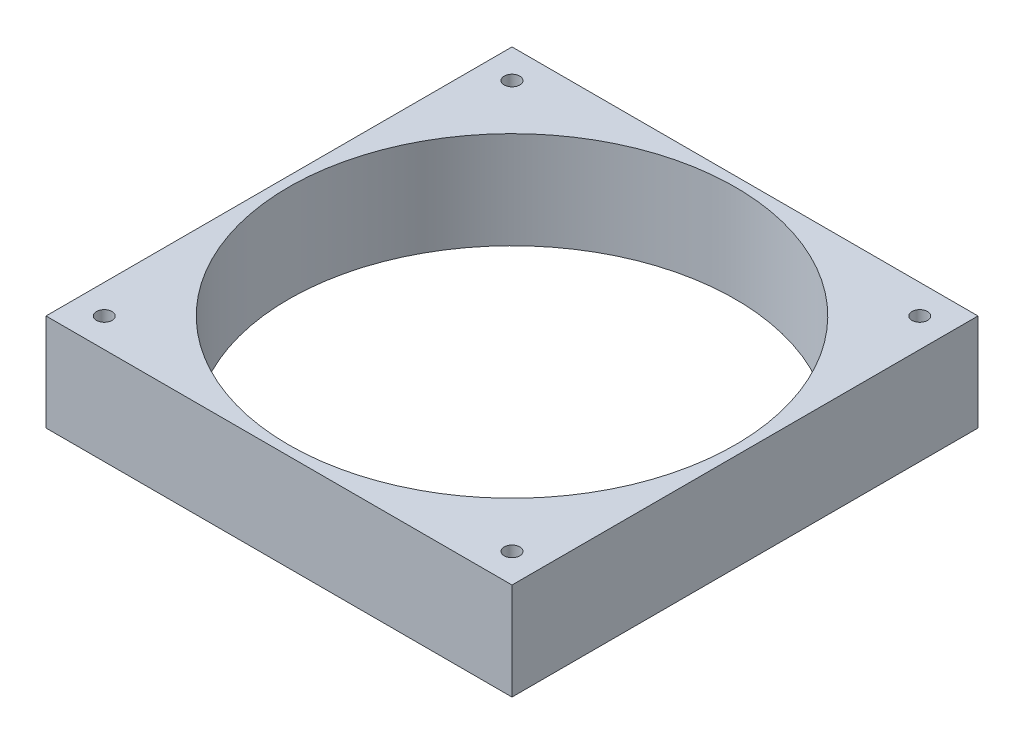
from build123d import *

# Parameters (mm, degrees)
SKETCH1_W           = 120
SKETCH1_H           = 120
BOSS_EXTRUDE1_DEPTH = 25
SKETCH2_R           = 2
CUT_EXTRUDE1_DEPTH  = 172.537167984
SKETCH_1_R          = 57.5
CUT_EXTRUDE_1_DEPTH = 100


with BuildPart() as part:
    # Sketch1 → Boss-Extrude1 (new body)
    with BuildSketch(Plane(origin=(0, 0, 0), x_dir=(1, 0, 0), z_dir=(0, 1, 0))):
        with Locations((60, -60)):
            Rectangle(SKETCH1_W, SKETCH1_H)
    extrude(amount=BOSS_EXTRUDE1_DEPTH)

    # Sketch2 → Cut-Extrude1 (cut, through all)
    with BuildSketch(Plane(origin=(0, 25, 0), x_dir=(1, 0, 0), z_dir=(0, 1, 0))):
        with Locations(Location((7.5, -112.5, 0), (0, 0, 270))):
            Circle(SKETCH2_R)
        with Locations(Location((112.5, -112.5, 0), (0, 0, 270))):
            Circle(SKETCH2_R)
        with Locations(Location((112.5, -7.5, 0), (0, 0, 270))):
            Circle(SKETCH2_R)
        with Locations(Location((7.5, -7.5, 0), (0, 0, 270))):
            Circle(SKETCH2_R)
    extrude(amount=-CUT_EXTRUDE1_DEPTH, mode=Mode.SUBTRACT)

    # 草图1 → 切除-拉伸1 (cut)
    with BuildSketch(Plane(origin=(0, 25, 0), x_dir=(1, 0, 0), z_dir=(0, 1, 0))):
        with Locations(Location((60, -60, 0), (0, 0, 270))):
            Circle(SKETCH_1_R)
    extrude(amount=-CUT_EXTRUDE_1_DEPTH, mode=Mode.SUBTRACT)


solid = part.part
